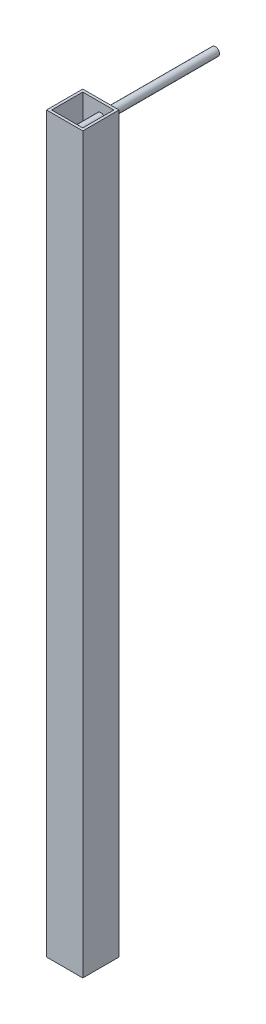
from build123d import *

# Parameters (mm, degrees)
SKETCH1_W           = 35
SKETCH1_H           = 35
SKETCH1_W_2         = 30
SKETCH1_H_2         = 30
BOSS_EXTRUDE1_DEPTH = 708
SKETCH2_R           = 4
BOSS_EXTRUDE2_DEPTH = 140.5


with BuildPart() as part:
    # Sketch1 → Boss-Extrude1 (new body)
    with BuildSketch(Plane(origin=(0, 0, 0), x_dir=(1, 0, 0), z_dir=(0, 1, 0))):
        Rectangle(SKETCH1_W, SKETCH1_H)
        Rectangle(SKETCH1_W_2, SKETCH1_H_2, mode=Mode.SUBTRACT)
    extrude(amount=BOSS_EXTRUDE1_DEPTH)

    # Sketch2 → Boss-Extrude2 (add)
    with BuildSketch(Plane(origin=(0, 0, 15), x_dir=(-1, 0, 0), z_dir=(0, 0, -1))):
        with Locations(Location((-2.4686271, 695.477178337, 0), (0, 0, 180))):
            Circle(SKETCH2_R)
    extrude(amount=BOSS_EXTRUDE2_DEPTH)


solid = part.part
